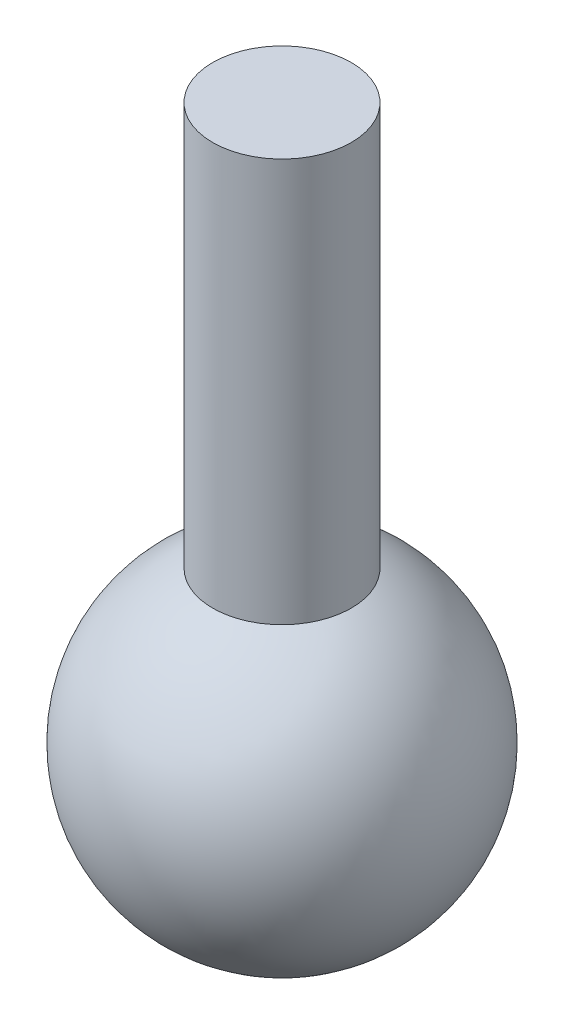
from build123d import *

# Parameters (mm, degrees)
SKETCH2_R           = 2.5
BOSS_EXTRUDE1_DEPTH = 20


with BuildPart() as part:
    # Sketch1 → Revolve1 (revolve)
    with BuildSketch(Plane(origin=(0, 0, 0), x_dir=(0, 0, -1), z_dir=(1, 0, 0))):
        with BuildLine():
            Line((0, 6), (0, -6))
            ThreePointArc((0, -6), (6, 0), (0, 6))
        make_face()
    revolve(axis=Axis((0, 6, 0), (0, -1, 0)))

    # Sketch2 → Boss-Extrude1 (add)
    with BuildSketch(Plane(origin=(0, 0, 0), x_dir=(1, 0, 0), z_dir=(0, 1, 0))):
        with Locations(Location((0, 0, 0), (0, 0, 90))):
            Circle(SKETCH2_R)
    extrude(amount=BOSS_EXTRUDE1_DEPTH)


solid = part.part
